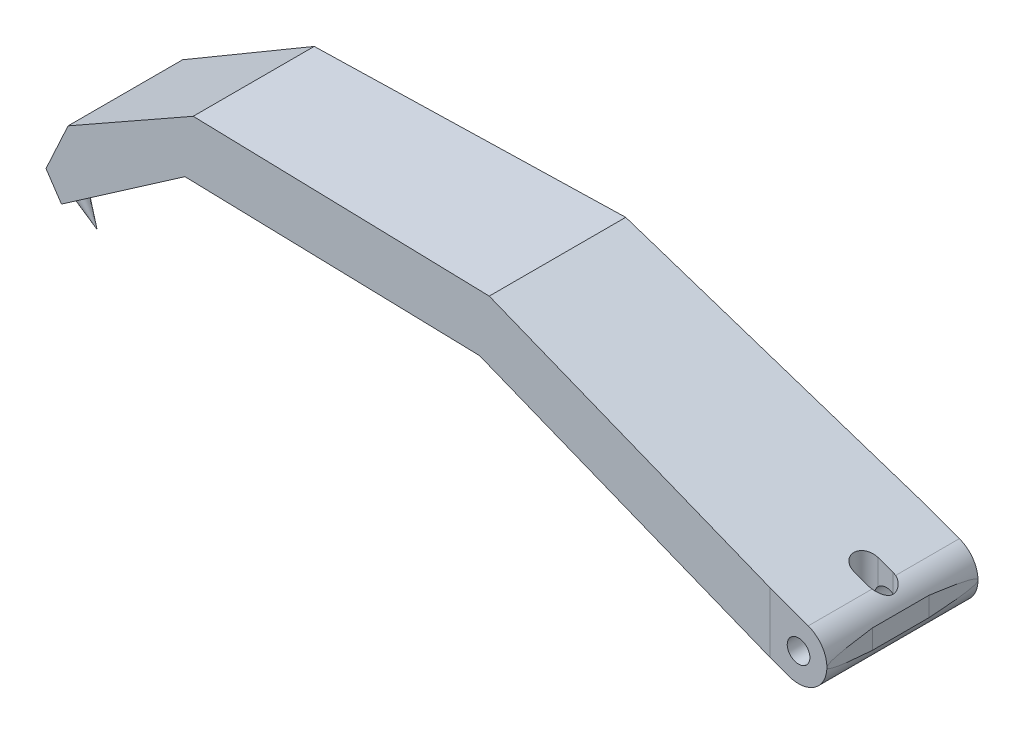
from build123d import *

# Parameters (mm, degrees)
BOSS_EXTRUDE2_DEPTH      = 10
BOSS_EXTRUDE2_DEPTH_BACK = 10
SKETCH3_R                = 1.5
TOP_FORM_DEPTH           = 105.378363468
TOP_FORM_DEPTH_BACK      = 105.378363468
SKETCH12_OUTSIDE_W       = 129.881
SKETCH12_OUTSIDE_H       = 44.03


with BuildPart() as part:
    # Sketch3 → Boss-Extrude2 (new, two sides: drawn at the far end of the back side and taken through both)
    with BuildSketch(Plane.XY.offset(-BOSS_EXTRUDE2_DEPTH_BACK)):
        with BuildLine():
            Line((1.282575537, 3.523847328), (-41.906339045, 19.243326686))
            Line((-41.906339045, 19.243326686), (-82.109540341, 19.243326686))
            Line((-82.109540341, 19.243326686), (-99.100622615, 9.433520762))
            Line((-99.100622615, 9.433520762), (-102.100622615, 3))
            Line((-102.100622615, 3), (-100, 0))
            Line((-100, 0), (-83.2287914, 11.743326686))
            Line((-83.2287914, 11.743326686), (-43.2287914, 11.743326686))
            Line((-43.2287914, 11.743326686), (-1.282575537, -3.523847328))
            ThreePointArc((-1.282575537, -3.523847328), (3.523847328, -1.282575537), (1.282575537, 3.523847328))
        make_face()
        Circle(SKETCH3_R, mode=Mode.SUBTRACT)
    extrude(amount=BOSS_EXTRUDE2_DEPTH + BOSS_EXTRUDE2_DEPTH_BACK)

    # Sketch12 outside → top-form (cut, two sides: drawn at the far end of the back side and taken through both)
    # profile 1 of 2: a face of its own
    with BuildSketch(Plane(origin=(0, 0, 0), x_dir=(1, 0, 0), z_dir=(0, 1, 0)).offset(-TOP_FORM_DEPTH_BACK)):
        with Locations((-49.1755, 0)):
            Rectangle(SKETCH12_OUTSIDE_W, SKETCH12_OUTSIDE_H)
        Polygon((3.523847328, -3.75), (3.523847328, 3.75), (3.75, 10), (-3.75, 10), (-102.100622615, 7.5), (-102.100622615, -7.5), (-3.75, -10), (3.75, -10), align=None, mode=Mode.SUBTRACT)
    # profile 2 of 2: a face of its own
    with BuildSketch(Plane(origin=(0, 0, 0), x_dir=(1, 0, 0), z_dir=(0, 1, 0)).offset(-TOP_FORM_DEPTH_BACK)):
        with BuildLine():
            ThreePointArc((0.923847328, -1.6), (2.523847328, 0), (0.923847328, 1.6))
            Line((0.923847328, 1.6), (-1.076152672, 1.6))
            ThreePointArc((-1.076152672, 1.6), (-2.676152672, 0), (-1.076152672, -1.6))
            Line((-1.076152672, -1.6), (0.923847328, -1.6))
        make_face()
    extrude(amount=TOP_FORM_DEPTH + TOP_FORM_DEPTH_BACK, mode=Mode.SUBTRACT)

    # spikes cone 1 section (through the dimple's axis) → spikes (revolve)
    with BuildSketch(Plane(origin=(-98.771271934, 0.860364655, 6.08430449), x_dir=(0, 0, 1), z_dir=(0.819152044, 0.573576436, 0))):
        Polygon((0, 0), (0.75, 0), (0, 3.528472582), align=None)
    revolve(axis=Axis((-98.771271934, 0.860364655, 6.08430449), (0.573576436, -0.819152044, 0)))

    # spikes cone 2 section (through the dimple's axis) → spikes cone 2 (revolve)
    with BuildSketch(Plane(origin=(-98.771271934, 0.860364655, -6.08430449), x_dir=(0, 0, 1), z_dir=(0.819152044, 0.573576436, 0))):
        Polygon((0, 0), (0.75, 0), (0, 3.528472582), align=None)
    revolve(axis=Axis((-98.771271934, 0.860364655, -6.08430449), (0.573576436, -0.819152044, 0)))


solid = part.part
